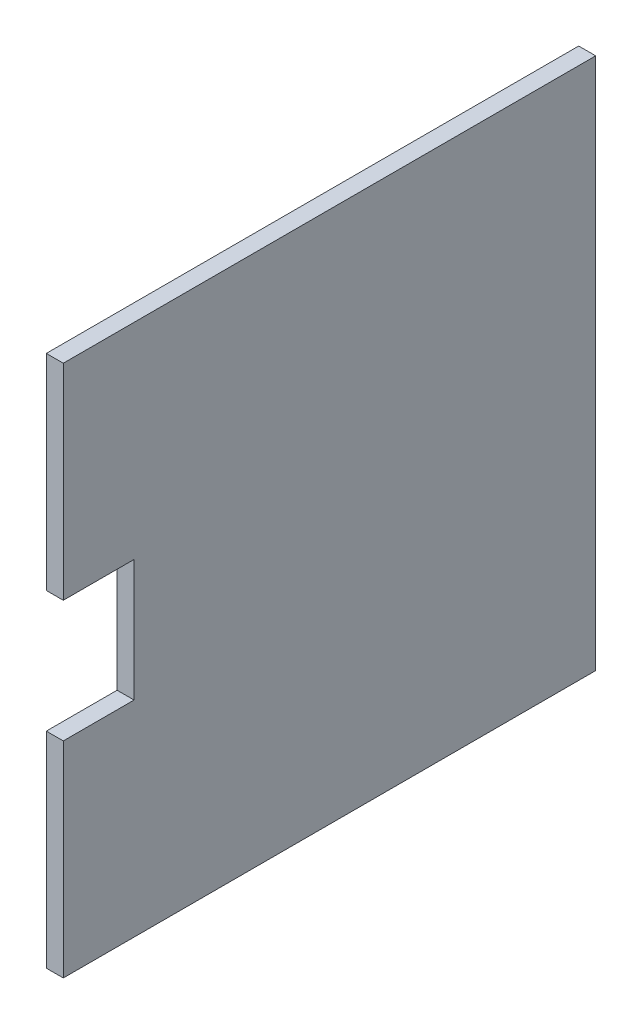
from build123d import *

# Parameters (mm, degrees)
BOSS_EXTRUDE1_DEPTH = 6


with BuildPart() as part:
    # Sketch1 → Boss-Extrude1 (new body)
    with BuildSketch(Plane(origin=(0, 0, 0), x_dir=(0, 0, -1), z_dir=(1, 0, 0))):
        Polygon((-81.03030303, -37.59069275), (-81.03030303, -110.09069275), (106.96969697, -110.09069275), (106.96969697, 77.90930725), (-81.03030303, 77.90930725), (-81.03030303, 5.40930725), (-56.03030303, 5.40930725), (-56.03030303, -16.09069275), (-56.03030303, -37.59069275), align=None)
    extrude(amount=BOSS_EXTRUDE1_DEPTH)


solid = part.part
